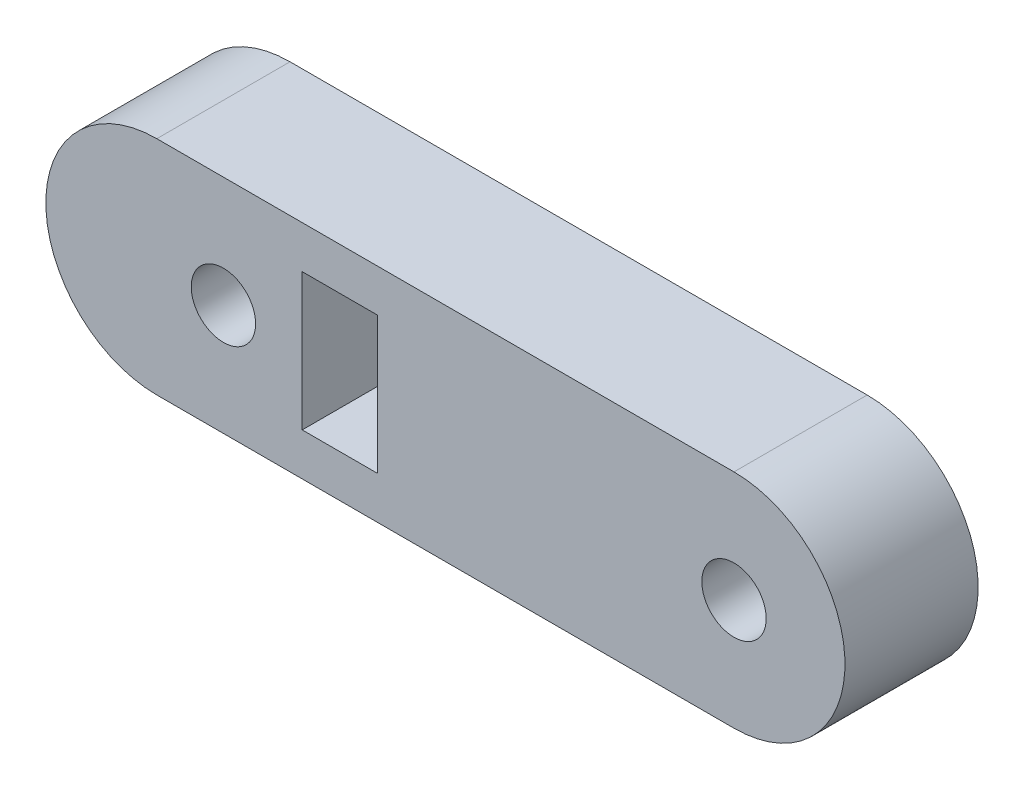
from build123d import *

# Parameters (mm, degrees)
SKETCH1_R           = 1.45
SKETCH1_W           = 3.400011
SKETCH1_H           = 6.173462
BOSS_EXTRUDE1_DEPTH = 6


with BuildPart() as part:
    # Sketch1 → Boss-Extrude1 (new body)
    with BuildSketch(Plane.XY):
        with BuildLine():
            Line((589.771388, 465.482899), (612.771388, 465.482899))
            ThreePointArc((612.771388, 465.482899), (617.771388, 460.482899), (612.771388, 455.482899))
            Line((612.771388, 455.482899), (589.771388, 455.482899))
            Line((589.771388, 455.482899), (586.771388, 455.482899))
            ThreePointArc((586.771388, 455.482899), (581.771388, 460.482899), (586.771388, 465.482899))
            Line((586.771388, 465.482899), (589.771388, 465.482899))
        make_face()
        with Locations((589.771388, 460.482899)):
            Circle(SKETCH1_R, mode=Mode.SUBTRACT)
        with Locations((612.771388, 460.482899)):
            Circle(SKETCH1_R, mode=Mode.SUBTRACT)
        with Locations((595.0213935, 460.482899)):
            Rectangle(SKETCH1_W, SKETCH1_H, mode=Mode.SUBTRACT)
    extrude(amount=BOSS_EXTRUDE1_DEPTH)


solid = part.part
